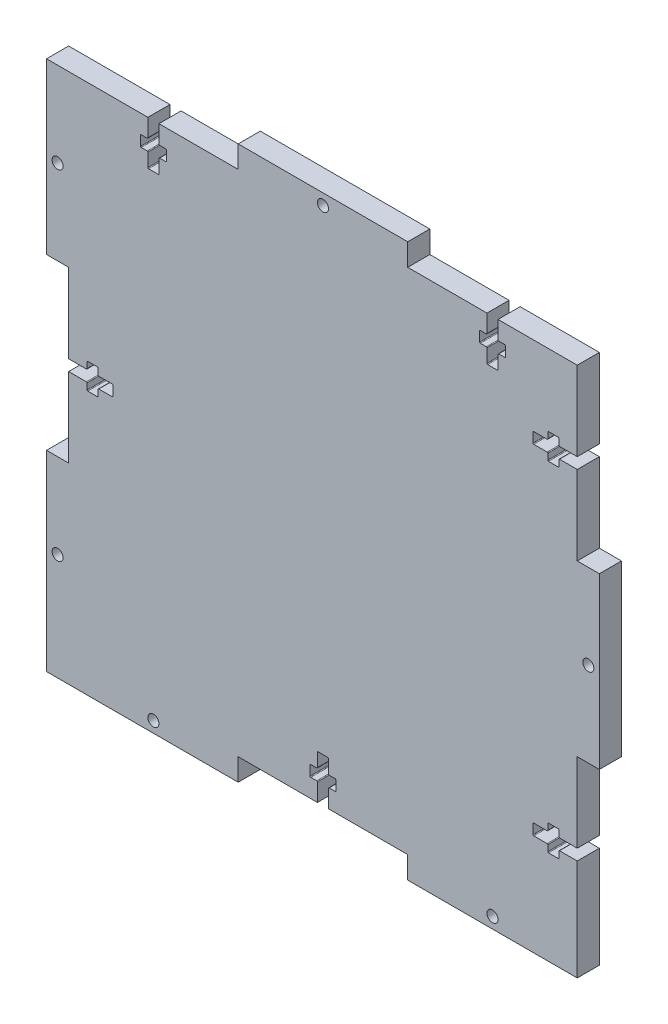
from build123d import *

# Parameters (mm, degrees)
BOX_SIDE_DEPTH       = 6
SKETCH2_R            = 1.5
SCREW_CUT_OUTS_DEPTH = 107.235587258


with BuildPart() as part:
    # Sketch1 → Box Side (new body)
    with BuildSketch(Plane.XY):
        Polygon((-69, 69), (-23, 69), (-23, 75), (23, 75), (23, 69), (69, 69), (69, 23), (75, 23), (75, -23), (69, -23), (69, -69), (69, -75), (23, -75), (23, -69), (-23, -69), (-23, -75), (-69, -75), (-75, -75), (-75, -69), (-75, -23), (-69, -23), (-69, 23), (-75, 23), (-75, 69), align=None)
    extrude(amount=BOX_SIDE_DEPTH)

    # Sketch2 → Screw Cut-outs (cut, through all)
    with BuildSketch(Plane.XY.offset(6)):
        with Locations((0, 72)):
            Circle(SKETCH2_R)
        with Locations(Location((72, 0, 0), (0, 0, 180))):
            Circle(SKETCH2_R)
        with Locations((-46, -72)):
            Circle(SKETCH2_R)
        with Locations(Location((46, -72, 0), (0, 0, 180))):
            Circle(SKETCH2_R)
        with Locations((-72, 46)):
            Circle(SKETCH2_R)
        with Locations(Location((-72, -46, 0), (0, 0, 180))):
            Circle(SKETCH2_R)
        with BuildLine():
            Line((-44.5, 69), (-44.5, 64.2))
            ThreePointArc((-44.5, 64.2), (-44.441421356, 64.058578644), (-44.3, 64))
            Line((-44.3, 64), (-42.7, 64))
            ThreePointArc((-42.7, 64), (-42.558578644, 63.941421356), (-42.5, 63.8))
            Line((-42.5, 63.8), (-42.5, 61.2))
            ThreePointArc((-42.5, 61.2), (-42.558578644, 61.058578644), (-42.7, 61))
            Line((-42.7, 61), (-44.3, 61))
            ThreePointArc((-44.3, 61), (-44.441421356, 60.941421356), (-44.5, 60.8))
            Line((-44.5, 60.8), (-44.5, 57.2))
            ThreePointArc((-44.5, 57.2), (-44.558578644, 57.058578644), (-44.7, 57))
            Line((-44.7, 57), (-47.3, 57))
            ThreePointArc((-47.3, 57), (-47.441421356, 57.058578644), (-47.5, 57.2))
            Line((-47.5, 57.2), (-47.5, 60.8))
            ThreePointArc((-47.5, 60.8), (-47.558578644, 60.941421356), (-47.7, 61))
            Line((-47.7, 61), (-49.3, 61))
            ThreePointArc((-49.3, 61), (-49.441421356, 61.058578644), (-49.5, 61.2))
            Line((-49.5, 61.2), (-49.5, 63.8))
            ThreePointArc((-49.5, 63.8), (-49.441421356, 63.941421356), (-49.3, 64))
            Line((-49.3, 64), (-47.7, 64))
            ThreePointArc((-47.7, 64), (-47.558578644, 64.058578644), (-47.5, 64.2))
            Line((-47.5, 64.2), (-47.5, 69))
            Line((-47.5, 69), (-44.5, 69))
        make_face()
        with BuildLine():
            Line((47.5, 69), (47.5, 64.2))
            ThreePointArc((47.5, 64.2), (47.558578644, 64.058578644), (47.7, 64))
            Line((47.7, 64), (49.3, 64))
            ThreePointArc((49.3, 64), (49.441421356, 63.941421356), (49.5, 63.8))
            Line((49.5, 63.8), (49.5, 61.2))
            ThreePointArc((49.5, 61.2), (49.441421356, 61.058578644), (49.3, 61))
            Line((49.3, 61), (47.7, 61))
            ThreePointArc((47.7, 61), (47.558578644, 60.941421356), (47.5, 60.8))
            Line((47.5, 60.8), (47.5, 57.2))
            ThreePointArc((47.5, 57.2), (47.441421356, 57.058578644), (47.3, 57))
            Line((47.3, 57), (44.7, 57))
            ThreePointArc((44.7, 57), (44.558578644, 57.058578644), (44.5, 57.2))
            Line((44.5, 57.2), (44.5, 60.8))
            ThreePointArc((44.5, 60.8), (44.441421356, 60.941421356), (44.3, 61))
            Line((44.3, 61), (42.7, 61))
            ThreePointArc((42.7, 61), (42.558578644, 61.058578644), (42.5, 61.2))
            Line((42.5, 61.2), (42.5, 63.8))
            ThreePointArc((42.5, 63.8), (42.558578644, 63.941421356), (42.7, 64))
            Line((42.7, 64), (44.3, 64))
            ThreePointArc((44.3, 64), (44.441421356, 64.058578644), (44.5, 64.2))
            Line((44.5, 64.2), (44.5, 69))
            Line((44.5, 69), (47.5, 69))
        make_face()
        with BuildLine():
            Line((69, 44.5), (64.2, 44.5))
            ThreePointArc((64.2, 44.5), (64.058578644, 44.441421356), (64, 44.3))
            Line((64, 44.3), (64, 42.7))
            ThreePointArc((64, 42.7), (63.941421356, 42.558578644), (63.8, 42.5))
            Line((63.8, 42.5), (61.2, 42.5))
            ThreePointArc((61.2, 42.5), (61.058578644, 42.558578644), (61, 42.7))
            Line((61, 42.7), (61, 44.3))
            ThreePointArc((61, 44.3), (60.941421356, 44.441421356), (60.8, 44.5))
            Line((60.8, 44.5), (57.2, 44.5))
            ThreePointArc((57.2, 44.5), (57.058578644, 44.558578644), (57, 44.7))
            Line((57, 44.7), (57, 47.3))
            ThreePointArc((57, 47.3), (57.058578644, 47.441421356), (57.2, 47.5))
            Line((57.2, 47.5), (60.8, 47.5))
            ThreePointArc((60.8, 47.5), (60.941421356, 47.558578644), (61, 47.7))
            Line((61, 47.7), (61, 49.3))
            ThreePointArc((61, 49.3), (61.058578644, 49.441421356), (61.2, 49.5))
            Line((61.2, 49.5), (63.8, 49.5))
            ThreePointArc((63.8, 49.5), (63.941421356, 49.441421356), (64, 49.3))
            Line((64, 49.3), (64, 47.7))
            ThreePointArc((64, 47.7), (64.058578644, 47.558578644), (64.2, 47.5))
            Line((64.2, 47.5), (69, 47.5))
            Line((69, 47.5), (69, 44.5))
        make_face()
        with BuildLine():
            Line((69, -47.5), (64.2, -47.5))
            ThreePointArc((64.2, -47.5), (64.058578644, -47.558578644), (64, -47.7))
            Line((64, -47.7), (64, -49.3))
            ThreePointArc((64, -49.3), (63.941421356, -49.441421356), (63.8, -49.5))
            Line((63.8, -49.5), (61.2, -49.5))
            ThreePointArc((61.2, -49.5), (61.058578644, -49.441421356), (61, -49.3))
            Line((61, -49.3), (61, -47.7))
            ThreePointArc((61, -47.7), (60.941421356, -47.558578644), (60.8, -47.5))
            Line((60.8, -47.5), (57.2, -47.5))
            ThreePointArc((57.2, -47.5), (57.058578644, -47.441421356), (57, -47.3))
            Line((57, -47.3), (57, -44.7))
            ThreePointArc((57, -44.7), (57.058578644, -44.558578644), (57.2, -44.5))
            Line((57.2, -44.5), (60.8, -44.5))
            ThreePointArc((60.8, -44.5), (60.941421356, -44.441421356), (61, -44.3))
            Line((61, -44.3), (61, -42.7))
            ThreePointArc((61, -42.7), (61.058578644, -42.558578644), (61.2, -42.5))
            Line((61.2, -42.5), (63.8, -42.5))
            ThreePointArc((63.8, -42.5), (63.941421356, -42.558578644), (64, -42.7))
            Line((64, -42.7), (64, -44.3))
            ThreePointArc((64, -44.3), (64.058578644, -44.441421356), (64.2, -44.5))
            Line((64.2, -44.5), (69, -44.5))
            Line((69, -44.5), (69, -47.5))
        make_face()
        with BuildLine():
            Line((-1.5, -69), (1.5, -69))
            Line((1.5, -69), (1.5, -64.2))
            ThreePointArc((1.5, -64.2), (1.558578644, -64.058578644), (1.7, -64))
            Line((1.7, -64), (3.3, -64))
            ThreePointArc((3.3, -64), (3.441421356, -63.941421356), (3.5, -63.8))
            Line((3.5, -63.8), (3.5, -61.2))
            ThreePointArc((3.5, -61.2), (3.441421356, -61.058578644), (3.3, -61))
            Line((3.3, -61), (1.7, -61))
            ThreePointArc((1.7, -61), (1.558578644, -60.941421356), (1.5, -60.8))
            Line((1.5, -60.8), (1.5, -57.2))
            ThreePointArc((1.5, -57.2), (1.441421356, -57.058578644), (1.3, -57))
            Line((1.3, -57), (-1.3, -57))
            ThreePointArc((-1.3, -57), (-1.441421356, -57.058578644), (-1.5, -57.2))
            Line((-1.5, -57.2), (-1.5, -60.8))
            ThreePointArc((-1.5, -60.8), (-1.558578644, -60.941421356), (-1.7, -61))
            Line((-1.7, -61), (-3.3, -61))
            ThreePointArc((-3.3, -61), (-3.441421356, -61.058578644), (-3.5, -61.2))
            Line((-3.5, -61.2), (-3.5, -63.8))
            ThreePointArc((-3.5, -63.8), (-3.441421356, -63.941421356), (-3.3, -64))
            Line((-3.3, -64), (-1.7, -64))
            ThreePointArc((-1.7, -64), (-1.558578644, -64.058578644), (-1.5, -64.2))
            Line((-1.5, -64.2), (-1.5, -69))
        make_face()
        with BuildLine():
            Line((-69, -1.5), (-64.2, -1.5))
            ThreePointArc((-64.2, -1.5), (-64.058578644, -1.558578644), (-64, -1.7))
            Line((-64, -1.7), (-64, -3.3))
            ThreePointArc((-64, -3.3), (-63.941421356, -3.441421356), (-63.8, -3.5))
            Line((-63.8, -3.5), (-61.2, -3.5))
            ThreePointArc((-61.2, -3.5), (-61.058578644, -3.441421356), (-61, -3.3))
            Line((-61, -3.3), (-61, -1.7))
            ThreePointArc((-61, -1.7), (-60.941421356, -1.558578644), (-60.8, -1.5))
            Line((-60.8, -1.5), (-57.2, -1.5))
            ThreePointArc((-57.2, -1.5), (-57.058578644, -1.441421356), (-57, -1.3))
            Line((-57, -1.3), (-57, 1.3))
            ThreePointArc((-57, 1.3), (-57.058578644, 1.441421356), (-57.2, 1.5))
            Line((-57.2, 1.5), (-60.8, 1.5))
            ThreePointArc((-60.8, 1.5), (-60.941421356, 1.558578644), (-61, 1.7))
            Line((-61, 1.7), (-61, 3.3))
            ThreePointArc((-61, 3.3), (-61.058578644, 3.441421356), (-61.2, 3.5))
            Line((-61.2, 3.5), (-63.8, 3.5))
            ThreePointArc((-63.8, 3.5), (-63.941421356, 3.441421356), (-64, 3.3))
            Line((-64, 3.3), (-64, 1.7))
            ThreePointArc((-64, 1.7), (-64.058578644, 1.558578644), (-64.2, 1.5))
            Line((-64.2, 1.5), (-69, 1.5))
            Line((-69, 1.5), (-69, -1.5))
        make_face()
    extrude(amount=-SCREW_CUT_OUTS_DEPTH, mode=Mode.SUBTRACT)


solid = part.part
